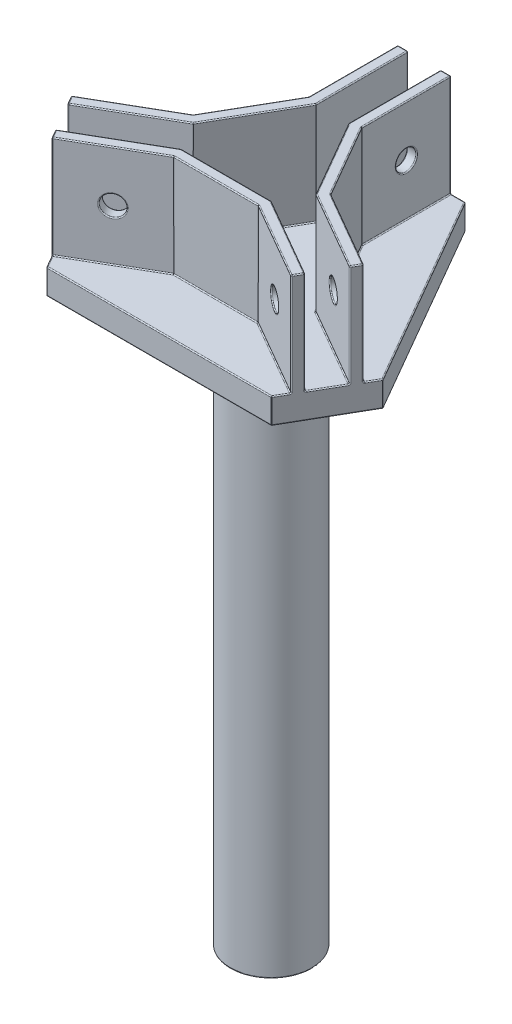
from build123d import *

# Parameters (mm, degrees)
SALIENTE_EXTRUIR1_DEPTH = 2.5
SALIENTE_EXTRUIR2_DEPTH = 10
CROQUIS3_R              = 4
SALIENTE_EXTRUIR3_DEPTH = 55
CROQUIS5_R              = 1.0000000000000013
CORTAR_EXTRUIR1_DEPTH   = 59.86844089436491
MATRIZC1_COUNT          = 3
REDONDEO1_R             = 0.1


with BuildPart() as part:
    # Croquis1 → Saliente-Extruir1 (new body)
    with BuildSketch(Plane(origin=(0, 0, 0), x_dir=(1, 0, 0), z_dir=(0, 1, 0))):
        Polygon((-4, 15.011106998930337), (4, 15.011106998930337), (14.999999999999996, -4.041451884327488), (10.999999999999964, -10.969655114602979), (-11.000000000000034, -10.96965511460298), (-15.00000000000007, -4.0414518843274925), align=None)
    extrude(amount=SALIENTE_EXTRUIR1_DEPTH)

    # Croquis2 → Saliente-Extruir2 (add)
    with BuildSketch(Plane(origin=(0, 2.5, 0), x_dir=(1, 0, 0), z_dir=(0, 1, 0))):
        Polygon((-12.200000000000044, -8.891194145520336), (-4.405771365940115, -4.391194145520304), (4.405771365940115, -4.391194145520304), (12.199999999999978, -8.891194145520322), (11.699999999999973, -9.757219549304756), (4.137822173508986, -5.391194145520304), (-4.137822173508992, -5.391194145520304), (-11.70000000000004, -9.757219549304772), align=None)
        Polygon((-1.599999999999993, 15.01110699893037), (-1.5999999999999976, 6.011106998930366), (-6.005771365940149, -1.6199128534100264), (-13.800000000000093, -6.119912853409909), (-14.30000000000008, -5.2538874496254655), (-6.73782217350902, -0.8878620458411405), (-2.5999999999999974, 6.2790561913614935), (-2.599999999999993, 15.01110699893037), align=None)
        Polygon((13.800000000000052, -6.119912853410149), (6.005771365940127, -1.6199128534101093), (1.6000000000000831, 6.011106998930344), (1.6000000000002237, 15.011106998930279), (2.6000000000002226, 15.011106998930261), (2.600000000000089, 6.279056191361452), (6.737822173509011, -0.8878620458412385), (14.300000000000052, -5.253887449625713), align=None)
    extrude(amount=SALIENTE_EXTRUIR2_DEPTH)

    # Croquis3 → Saliente-Extruir3 (add)
    with BuildSketch(Plane.XZ):
        with Locations(Location((0, 0, 0), (0, 0, 270))):
            Circle(CROQUIS3_R)
    extrude(amount=SALIENTE_EXTRUIR3_DEPTH)

    # Croquis5 → Cortar-Extruir1 (cut, through all)
    with BuildSketch(Plane(origin=(-1.2999999999999725, 0, -2.2516660498395478), x_dir=(-0.8660254037844439, 0, 0.49999999999999095), z_dir=(-0.49999999999999095, 0, -0.8660254037844439))):
        with Locations((10.645081595145923, 7.500000000000001)):
            Circle(CROQUIS5_R)
    cortar_extruir1 = extrude(amount=-CORTAR_EXTRUIR1_DEPTH, mode=Mode.SUBTRACT)

    # MatrizC1: Cortar-Extruir1 ×3 about axis
    matrizc1_axis = Axis((0, -55, 0), (0, 1, 0))
    for i in range(1, MATRIZC1_COUNT):
        add(cortar_extruir1.rotate(matrizc1_axis, i * 360 / MATRIZC1_COUNT), mode=Mode.SUBTRACT)

    # Redondeo1
    redondeo1_edges = [part.edges().sort_by_distance(p)[0] for p in [
        (-1.6000000000000063, 7.500000000000001, -9.645081595145939),
        (-2.6000000000000063, 7.500000000000001, -9.64508159514595),
        (1.6000000000001442, 7.500000000000001, -9.645081595145903),
        (2.6000000000000987, 7.500000000000001, -9.645081595145893),
        (-4, 1.25, -15.011106998930337),
        (4, 1.25, -15.011106998930337),
        (7.552885682970066, 7.500000000000001, 6.208181443628093),
        (9.152885682970098, 7.500000000000001, 3.4369001515179027),
        (9.652885682970107, 7.500000000000001, 2.5708747477334715),
        (14.999999999999996, 1.25, 4.041451884327488),
        (7.052885682970032, 7.500000000000001, 7.0742068474125706),
        (10.999999999999964, 1.25, 10.969655114602979),
        (-11.000000000000034, 1.25, 10.96965511460298),
        (-15.00000000000007, 1.25, 4.0414518843274925),
        (-3.553e-14, 2.5, 10.969655114602979),
        (11.34999999999997, 2.5, 10.363437331953868),
        (-11.350000000000037, 2.5, 10.363437331953875),
        (12.99999999999999, 2.5, 7.50555349946522),
        (9.499999999999998, 2.5, -5.484827557301426),
        (-12.200000000000044, 7.5, 8.891194145520336),
        (-7.918911086754516, 2.5, 7.574206847412538),
        (-11.70000000000004, 7.5, 9.757219549304772),
        (-2.66e-15, 2.5, 5.391194145520304),
        (-4.137822173508992, 7.5, 5.391194145520304),
        (7.918911086754479, 2.5, 7.57420684741253),
        (4.137822173508986, 7.5, 5.391194145520304),
        (3.300000000000111, 2.5, -15.011106998930337),
        (11.699999999999973, 7.5, 9.757219549304756),
        (8.302885682970047, 2.5, 6.641194145520313),
        (12.199999999999978, 7.5, 8.891194145520322),
        (0, 2.5, 4.391194145520304),
        (4.405771365940115, 7.5, 4.391194145520304),
        (-8.302885682970079, 2.5, 6.64119414552032),
        (-4.405771365940115, 7.5, 4.391194145520304),
        (-11.950000000000042, 12.5, 9.324206847412555),
        (-7.918911086754516, 12.5, 7.574206847412538),
        (-2.66e-15, 12.5, 5.391194145520304),
        (7.918911086754479, 12.5, 7.57420684741253),
        (11.949999999999974, 12.5, 9.324206847412539),
        (8.302885682970047, 12.5, 6.641194145520313),
        (0, 12.5, 4.391194145520304),
        (-8.302885682970079, 12.5, 6.64119414552032),
        (-3.2999999999999963, 2.5, -15.011106998930337),
        (-13.000000000000107, 2.5, 7.505553499465143),
        (-1.599999999999993, 7.5, -15.01110699893037),
        (-2.599999999999995, 2.5, -10.645081595145932),
        (-2.599999999999993, 7.5, -15.01110699893037),
        (-4.668911086754509, 2.5, -2.695597072760177),
        (-2.5999999999999974, 7.5, -6.2790561913614935),
        (-10.51891108675455, 2.5, 3.070874747733303),
        (-6.73782217350902, 7.5, 0.8878620458411405),
        (-14.30000000000008, 7.5, 5.2538874496254655),
        (-9.90288568297012, 2.5, 3.869912853409968),
        (-13.800000000000093, 7.5, 6.119912853409909),
        (-3.8028856829700732, 2.5, -2.1955970727601697),
        (-6.005771365940149, 7.5, 1.6199128534100264),
        (-1.5999999999999952, 2.5, -10.511106998930368),
        (-1.5999999999999976, 7.5, -6.011106998930366),
        (-2.099999999999993, 12.5, -15.01110699893037),
        (-2.599999999999995, 12.5, -10.645081595145932),
        (-4.668911086754509, 12.5, -2.695597072760177),
        (-10.51891108675455, 12.5, 3.070874747733303),
        (-14.050000000000086, 12.5, 5.686900151517687),
        (-9.90288568297012, 12.5, 3.869912853409968),
        (-3.8028856829700732, 12.5, -2.1955970727601697),
        (-1.5999999999999952, 12.5, -10.511106998930368),
        (-9.500000000000036, 2.5, -5.484827557301423),
        (1.1546e-13, 2.5, -15.011106998930337),
        (14.649999999999999, 2.5, 4.647669666976586),
        (13.800000000000052, 7.5, 6.119912853410149),
        (10.518911086754532, 2.5, 3.070874747733476),
        (14.300000000000052, 7.5, 5.253887449625713),
        (4.66891108675455, 2.5, -2.6955970727601066),
        (6.737822173509011, 7.5, 0.8878620458412385),
        (2.600000000000156, 2.5, -10.645081595145857),
        (2.600000000000089, 7.5, -6.279056191361452),
        (2.6000000000002226, 7.5, -15.011106998930261),
        (1.6000000000001535, 2.5, -10.511106998930313),
        (1.6000000000002237, 7.5, -15.011106998930279),
        (3.802885682970105, 2.5, -2.1955970727601173),
        (1.6000000000000831, 7.5, -6.011106998930344),
        (9.90288568297009, 2.5, 3.869912853410129),
        (6.005771365940127, 7.5, 1.6199128534101093),
        (14.050000000000052, 12.5, 5.686900151517931),
        (0, 0, -15.011106998930337),
        (10.518911086754532, 12.5, 3.070874747733476),
        (4.66891108675455, 12.5, -2.6955970727601066),
        (2.600000000000156, 12.5, -10.645081595145857),
        (2.100000000000223, 12.5, -15.01110699893027),
        (1.6000000000001535, 12.5, -10.511106998930313),
        (3.802885682970105, 12.5, -2.1955970727601173),
        (9.90288568297009, 12.5, 3.869912853410129),
        (9.499999999999998, 0, -5.484827557301426),
        (12.99999999999998, 0, 7.5055534994652335),
        (-3.553e-14, 0, 10.969655114602979),
        (-13.000000000000052, 0, 7.505553499465236),
        (-9.500000000000036, 0, -5.484827557301423),
        (1.22e-15, 0, 4),
        (-14.650000000000121, 2.5, 4.647669666976504),
        (1.22e-15, -55, 4),
        (-7.552885682970091, 7.500000000000001, 6.20818144362812),
        (-7.0528856829701, 7.500000000000001, 7.074206847412563),
        (-9.152885682970139, 7.500000000000001, 3.436900151517768),
        (-9.652885682970128, 7.500000000000001, 2.570874747733326),
    ]]
    fillet(redondeo1_edges, radius=REDONDEO1_R)


solid = part.part
